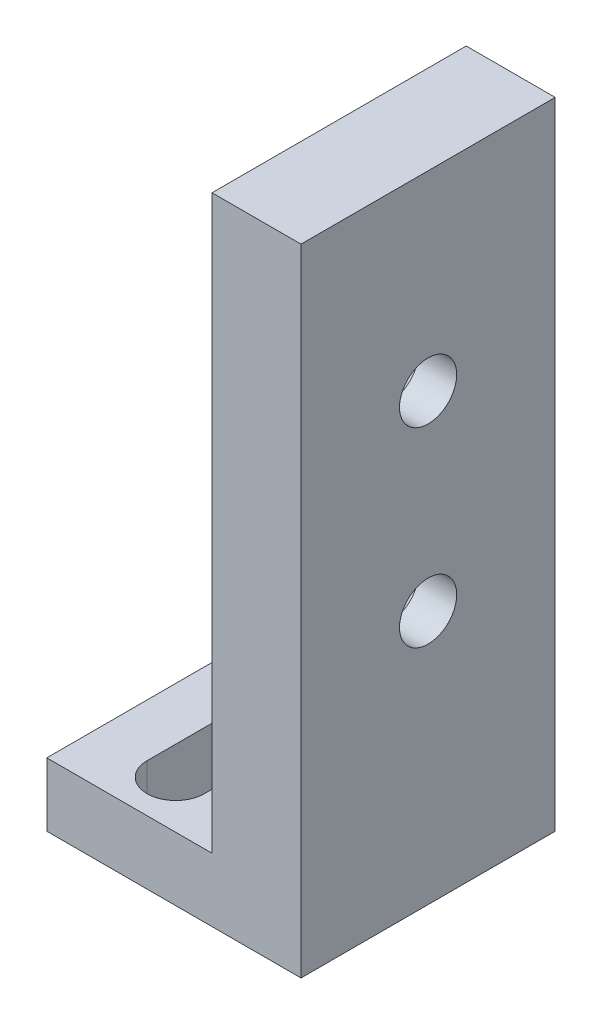
from build123d import *

# Parameters (mm, degrees)
RESSALTO_EXTRUS_O1_DEPTH = 20
CORTE_EXTRUS_O1_DEPTH    = 54.150729064
ESBO_O3_R                = 2.25
CORTE_EXTRUS_O2_DEPTH    = 56.398555938
ESBO_O3_3_R              = 2.25
CUT_EXTRUDE1_DEPTH       = 4


with BuildPart() as part:
    # Esboço1 → Ressalto-extrusão1 (new body)
    with BuildSketch(Plane.XY):
        Polygon((0, 0), (0, 5), (13, 5), (13, 50), (20, 50), (20, 0), align=None)
    extrude(amount=RESSALTO_EXTRUS_O1_DEPTH)

    # Esboço2 → Corte-extrusão1 (cut, through all)
    with BuildSketch(Plane(origin=(0, 5, 0), x_dir=(1, 0, 0), z_dir=(0, 1, 0))):
        with BuildLine():
            Line((8.64, -3.75), (8.64, -16.25))
            ThreePointArc((8.64, -16.25), (6.39, -18.5), (4.14, -16.25))
            Line((4.14, -16.25), (4.14, -3.75))
            ThreePointArc((4.14, -3.75), (6.39, -1.5), (8.64, -3.75))
        make_face()
    extrude(amount=-CORTE_EXTRUS_O1_DEPTH, mode=Mode.SUBTRACT)

    # Esboço3 → Corte-extrusão2 (cut, through all)
    with BuildSketch(Plane.ZY.offset(-13)):
        with Locations((10, 35)):
            Circle(ESBO_O3_R)
        with Locations((10, 20)):
            Circle(ESBO_O3_R)
    extrude(amount=-CORTE_EXTRUS_O2_DEPTH, mode=Mode.SUBTRACT)

    # Esboço3<3> → Cut-Extrude1 (cut)
    # profile 1 of 2: a face of its own
    with BuildSketch(Plane.ZY.offset(-13)):
        Polygon((5.958548116, 20), (7.979274058, 16.5), (12.020725942, 16.5), (14.041451884, 20), (12.020725942, 23.5), (7.979274058, 23.5), align=None)
        with Locations((10, 20)):
            Circle(ESBO_O3_3_R, mode=Mode.SUBTRACT)
    # profile 2 of 2: a face of its own
    with BuildSketch(Plane.ZY.offset(-13)):
        Polygon((5.958548116, 35), (7.979274058, 31.5), (12.020725942, 31.5), (14.041451884, 35), (12.020725942, 38.5), (7.979274058, 38.5), align=None)
        with Locations((10, 35)):
            Circle(ESBO_O3_3_R, mode=Mode.SUBTRACT)
    extrude(amount=-CUT_EXTRUDE1_DEPTH, mode=Mode.SUBTRACT)


solid = part.part
